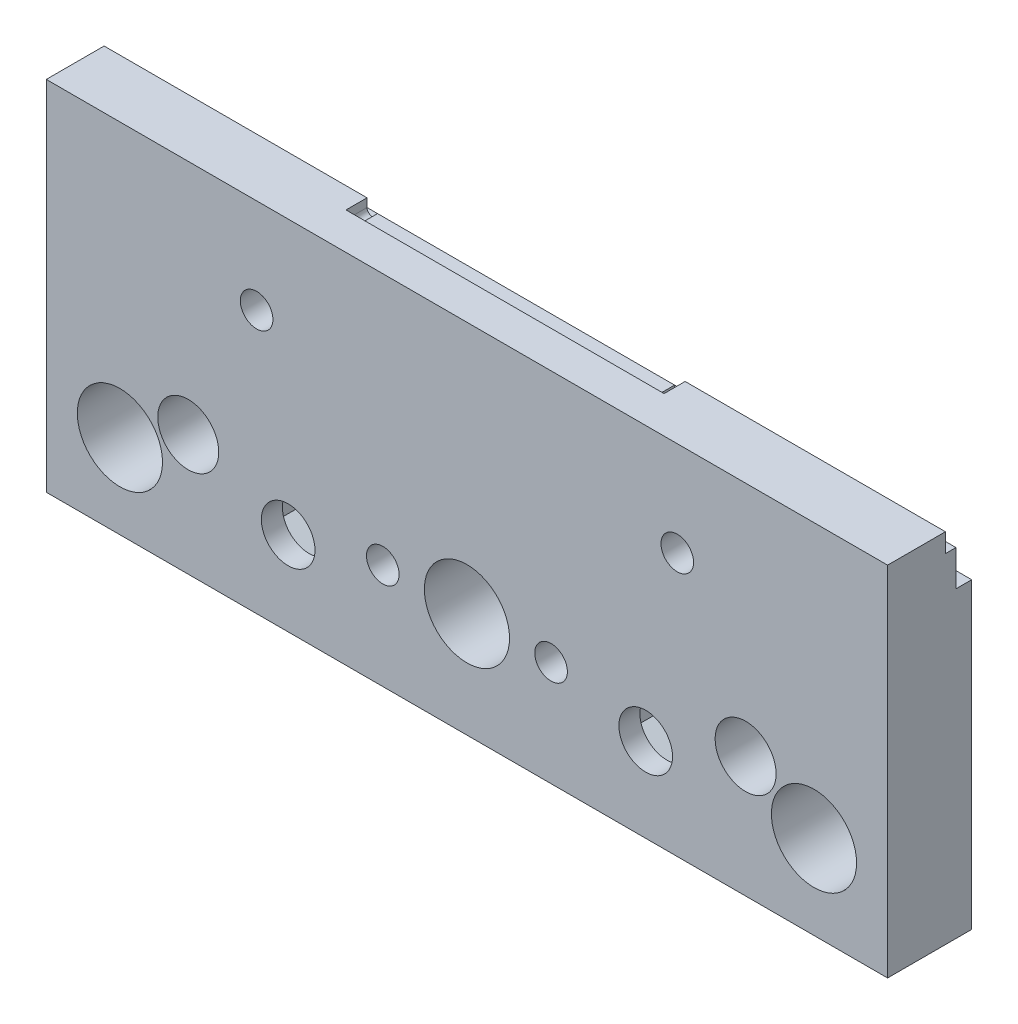
from build123d import *

# Parameters (mm, degrees)
SKETCH_2_W           = 80
SKETCH_2_H           = 34
SKETCH_2_R           = 4.05
EXTRUDE_1_DEPTH      = 8
SKETCH_3_R           = 2.55
CUT_EXTRUDE_1_DEPTH  = 88.292611371
CUT_EXTRUDE_2_DEPTH  = 88.292611371
SKETCH_5_R           = 1.55
CUT_EXTRUDE_3_DEPTH  = 88.292611371
CUT_EXTRUDE_15_DEPTH = 4.5
SKETCH_11_R          = 1.55
CUT_EXTRUDE_7_DEPTH  = 88.292611371
CUT_EXTRUDE_11_DEPTH = 2
SKETCH_21_R          = 2.9
CUT_EXTRUDE_13_DEPTH = 88.292611371
CUT_EXTRUDE_14_DEPTH = 6


with BuildPart() as part:
    # 草图2 → 凸台-拉伸1 (new body)
    with BuildSketch(Plane.XY):
        with Locations((40, 17)):
            Rectangle(SKETCH_2_W, SKETCH_2_H)
        with Locations((7, 8)):
            Circle(SKETCH_2_R, mode=Mode.SUBTRACT)
        with Locations((40, 10)):
            Circle(SKETCH_2_R, mode=Mode.SUBTRACT)
        with Locations((73, 8)):
            Circle(SKETCH_2_R, mode=Mode.SUBTRACT)
    extrude(amount=EXTRUDE_1_DEPTH)

    # 草图3 → 切除-拉伸1 (cut, through all)
    with BuildSketch(Plane.XY.offset(8)):
        with Locations((23, 8)):
            Circle(SKETCH_3_R)
        with Locations((57, 8)):
            Circle(SKETCH_3_R)
    extrude(amount=-CUT_EXTRUDE_1_DEPTH, mode=Mode.SUBTRACT)

    # 草图4 → 切除-拉伸2 (cut, through all)
    with BuildSketch(Plane(origin=(80, 0, 0), x_dir=(0, 0, -1), z_dir=(1, 0, 0))):
        Polygon((-1.5, 32.2), (-2.5, 32.2), (-2.5, 34), (0, 34), (0, 28.8), (-1.5, 28.8), align=None)
    extrude(amount=-CUT_EXTRUDE_2_DEPTH, mode=Mode.SUBTRACT)

    # 草图5 → 切除-拉伸3 (cut, through all)
    with BuildSketch(Plane.XY.offset(8)):
        with Locations((48, 10)):
            Circle(SKETCH_5_R)
        with Locations((32, 10)):
            Circle(SKETCH_5_R)
    extrude(amount=-CUT_EXTRUDE_3_DEPTH, mode=Mode.SUBTRACT)

    # 草图8 → 切除-拉伸15 (cut)
    with BuildSketch(Plane(origin=(0, 0, 0), x_dir=(-1, 0, 0), z_dir=(0, 0, -1))):
        Polygon((-48, 6.709103466), (-45.15, 8.354551733), (-45.15, 11.645448267), (-48, 13.290896534), (-50.85, 11.645448267), (-50.85, 8.354551733), align=None)
        Polygon((-34.85, 11.645448267), (-34.85, 8.354551733), (-32, 6.709103466), (-29.15, 8.354551733), (-29.15, 11.645448267), (-32, 13.290896534), align=None)
    extrude(amount=-CUT_EXTRUDE_15_DEPTH, mode=Mode.SUBTRACT)

    # 草图11 → 切除-拉伸7 (cut, through all)
    with BuildSketch(Plane(origin=(0, 0, 0), x_dir=(-1, 0, 0), z_dir=(0, 0, -1))):
        with Locations((-60, 25)):
            Circle(SKETCH_11_R)
        with Locations((-20, 25)):
            Circle(SKETCH_11_R)
    extrude(amount=-CUT_EXTRUDE_7_DEPTH, mode=Mode.SUBTRACT)

    # 草图19 → 切除-拉伸11 (cut)
    with BuildSketch(Plane(origin=(0, 0, 2.5), x_dir=(-1, 0, 0), z_dir=(0, 0, -1))):
        with BuildLine():
            Line((-25, 34), (-55.247938178, 34))
            Line((-55.247938178, 34), (-55.247938178, 33.2))
            ThreePointArc((-55.247938178, 33.2), (-54.747938178, 32.7), (-54.247938178, 33.2))
            Line((-54.247938178, 33.2), (-26, 33.2))
            ThreePointArc((-26, 33.2), (-25.5, 32.7), (-25, 33.2))
            Line((-25, 33.2), (-25, 34))
        make_face()
    extrude(amount=-CUT_EXTRUDE_11_DEPTH, mode=Mode.SUBTRACT)

    # 草图21 → 切除-拉伸13 (cut, through all)
    with BuildSketch(Plane(origin=(0, 0, 0), x_dir=(-1, 0, 0), z_dir=(0, 0, -1))):
        with Locations((-66.5, 11.5)):
            Circle(SKETCH_21_R)
        with Locations(Location((-13.5, 11.5, 0), (0, 0, 180))):
            Circle(SKETCH_21_R)
    extrude(amount=-CUT_EXTRUDE_13_DEPTH, mode=Mode.SUBTRACT)

    # 草图22 → 切除-拉伸14 (cut)
    with BuildSketch(Plane(origin=(0, 0, 0), x_dir=(-1, 0, 0), z_dir=(0, 0, -1))):
        Polygon((-52.9, 5.632863896), (-52.9, 10.367136104), (-57, 12.734272207), (-61.1, 10.367136104), (-61.1, 5.632863896), (-57, 3.265727793), align=None)
        Polygon((-23, 3.265727793), (-18.9, 5.632863896), (-18.9, 10.367136104), (-23, 12.734272207), (-27.1, 10.367136104), (-27.1, 5.632863896), align=None)
    extrude(amount=-CUT_EXTRUDE_14_DEPTH, mode=Mode.SUBTRACT)


solid = part.part
